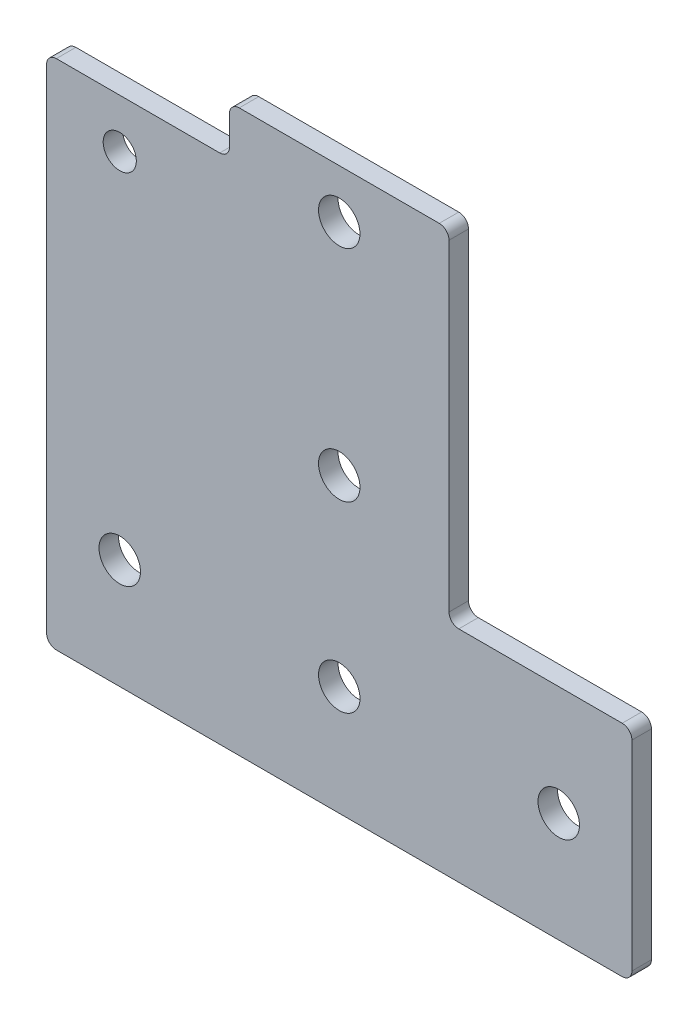
from build123d import *

# Parameters (mm, degrees)
SKETCH1_R           = 4.25
SKETCH1_R_2         = 3.4
BOSS_EXTRUDE1_DEPTH = 4
FILLET1_R           = 2


with BuildPart() as part:
    # Sketch1 → Boss-Extrude1 (new body)
    with BuildSketch(Plane.XY):
        Polygon((-60, 0), (60, 0), (60, 45), (22.5, 45), (22.5, 115), (-22.5, 115), (-22.5, 105), (-60, 105), (-60, 45), align=None)
        with Locations((0, 22.5)):
            Circle(SKETCH1_R, mode=Mode.SUBTRACT)
        with Locations((-45, 22.5)):
            Circle(SKETCH1_R, mode=Mode.SUBTRACT)
        with Locations((45, 22.5)):
            Circle(SKETCH1_R, mode=Mode.SUBTRACT)
        with Locations((0, 105)):
            Circle(SKETCH1_R, mode=Mode.SUBTRACT)
        with Locations((0, 60)):
            Circle(SKETCH1_R, mode=Mode.SUBTRACT)
        with Locations((-45, 95)):
            Circle(SKETCH1_R_2, mode=Mode.SUBTRACT)
    extrude(amount=BOSS_EXTRUDE1_DEPTH)

    # Fillet1
    fillet1_edges = [part.edges().sort_by_distance(p)[0] for p in [
        (-60, 105, 2),
        (-22.5, 105, 2),
        (-22.5, 115, 2),
        (22.5, 115, 2),
        (22.5, 45, 2),
        (60, 45, 2),
        (60, 0, 2),
        (-60, 0, 2),
    ]]
    fillet(fillet1_edges, radius=FILLET1_R)


solid = part.part
